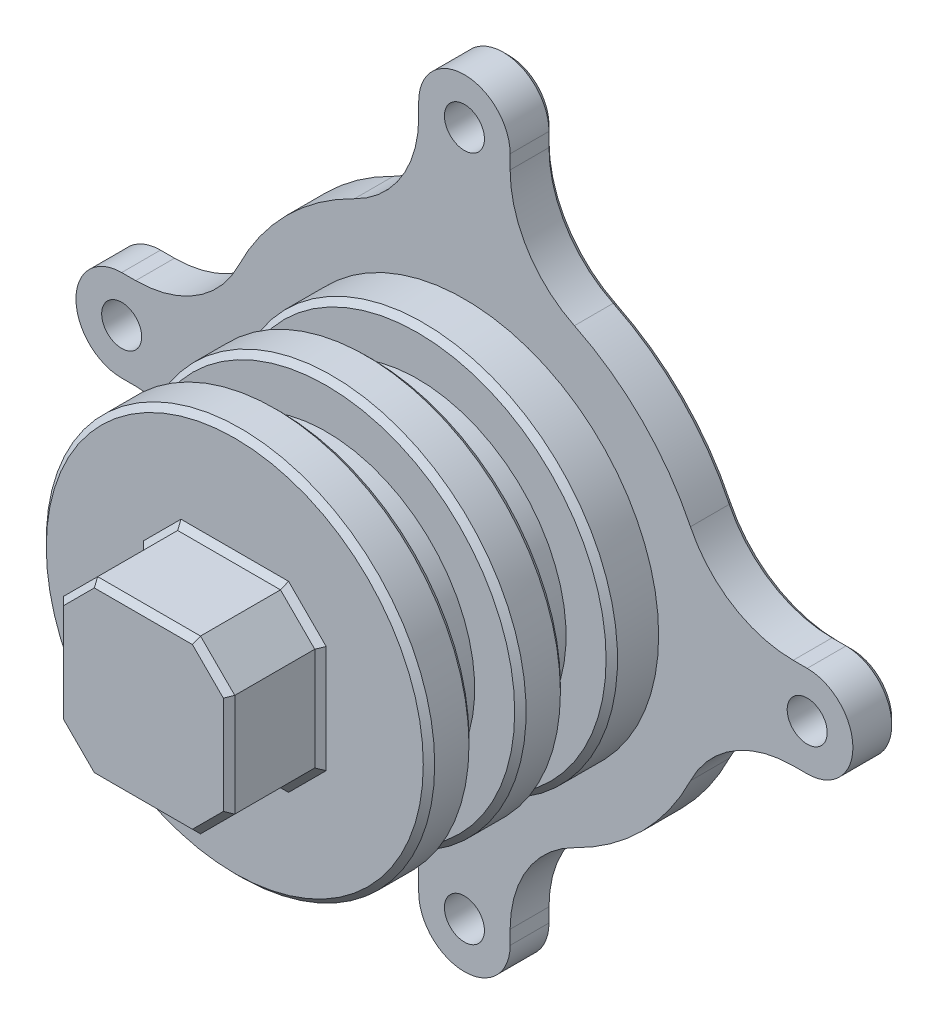
from build123d import *

# Parameters (mm, degrees)
SKETCH2_R           = 15
SKETCH1_R           = 25
SKETCH3_R           = 15
BOSS_EXTRUDE1_DEPTH = 5
FILLET1_R           = 10
SKETCH4_R           = 1.75
CUT_EXTRUDE1_DEPTH  = 130
SKETCH5_R           = 4
CUT_EXTRUDE2_DEPTH  = 130
SKETCH6_R           = 22
BOSS_EXTRUDE2_DEPTH = 4
SKETCH7_R           = 17
BOSS_EXTRUDE3_DEPTH = 20
SKETCH15_W          = 8.431609766
SKETCH15_H          = 4
SKETCH15_W_2        = 8.578672696
SKETCH18_R          = 12.5
CUT_EXTRUDE5_DEPTH  = 20
SKETCH19_R          = 47.987160243
CUT_EXTRUDE6_DEPTH  = 44.301270362
SKETCH20_R          = 1.75
BOSS_EXTRUDE5_DEPTH = 4
CIRPATTERN3_COUNT   = 4
FILLET2_R           = 10
CHAMFER1_SIZE       = 0.5
SKETCH22_W          = 15
SKETCH22_H          = 8
BOSS_EXTRUDE6_DEPTH = 7.5
CHAMFER2_SIZE       = 3
CHAMFER3_SIZE       = 0.5
CUT_EXTRUDE8_START  = -0.1
SKETCH24_R          = 41.017326151
SKETCH24_R_2        = 17
CUT_EXTRUDE8_DEPTH  = 0.1
CHAMFER4_SIZE       = 0.5


with BuildPart() as part:
    # Sketch2 → Loft1 section 0
    with BuildSketch(Plane.XY.offset(20)):
        Circle(SKETCH2_R)
    # Sketch1 → Loft1 section 1
    with BuildSketch(Plane.XY):
        Circle(SKETCH1_R)
    loft()

    # Sketch3 → Boss-Extrude1 (add)
    with BuildSketch(Plane.XY.offset(20)):
        Circle(SKETCH3_R)
    extrude(amount=BOSS_EXTRUDE1_DEPTH)

    # Fillet1
    fillet1_edges = [part.edges().sort_by_distance(p)[0] for p in [
        (-15, 0, 20),
    ]]
    fillet(fillet1_edges, radius=FILLET1_R)

    # Sketch4 → Cut-Extrude1 (cut)
    with BuildSketch(Plane(origin=(0, 0, 0), x_dir=(-1, 0, 0), z_dir=(0, 0, -1))):
        with Locations((0, 20)):
            Circle(SKETCH4_R)
        with Locations((-20, 0)):
            Circle(SKETCH4_R)
        with Locations((0, -20)):
            Circle(SKETCH4_R)
        with Locations((20, 0)):
            Circle(SKETCH4_R)
    extrude(amount=-CUT_EXTRUDE1_DEPTH, mode=Mode.SUBTRACT)

    # Sketch5 → Cut-Extrude2 (cut)
    with BuildSketch(Plane(origin=(0, 0, 3), x_dir=(-1, 0, 0), z_dir=(0, 0, -1))):
        with Locations((0, 20)):
            Circle(SKETCH5_R)
        with Locations((20, 0)):
            Circle(SKETCH5_R)
        with Locations((-20, 0)):
            Circle(SKETCH5_R)
        with Locations((0, -20)):
            Circle(SKETCH5_R)
    extrude(amount=-CUT_EXTRUDE2_DEPTH, mode=Mode.SUBTRACT)

    # Sketch6 → Boss-Extrude2 (add)
    with BuildSketch(Plane.XY.offset(25)):
        Circle(SKETCH6_R)
    extrude(amount=BOSS_EXTRUDE2_DEPTH)

    # Sketch7 → Boss-Extrude3 (add)
    with BuildSketch(Plane.XY.offset(29)):
        Circle(SKETCH7_R)
    extrude(amount=BOSS_EXTRUDE3_DEPTH)

    # Sketch15 → Cut-Revolve1 (revolve, cut)
    with BuildSketch(Plane(origin=(0, 0, 0), x_dir=(1, 0, 0), z_dir=(0, 1, 0))):
        with Locations((-17.215804883, -35)):
            Rectangle(SKETCH15_W, SKETCH15_H)
        with Locations((-17.289336348, -43)):
            Rectangle(SKETCH15_W_2, SKETCH15_H)
    revolve(axis=Axis((0, 0, 29), (0, 0, 1)), mode=Mode.SUBTRACT)

    # Sketch18 → Cut-Extrude5 (cut)
    with BuildSketch(Plane(origin=(0, 0, 0), x_dir=(-1, 0, 0), z_dir=(0, 0, -1))):
        Circle(SKETCH18_R)
    extrude(amount=-CUT_EXTRUDE5_DEPTH, mode=Mode.SUBTRACT)

    # Sketch19 → Cut-Extrude6 (cut, through all)
    with BuildSketch(Plane(origin=(0, 0, 25), x_dir=(-1, 0, 0), z_dir=(0, 0, -1))):
        Circle(SKETCH19_R)
    extrude(amount=CUT_EXTRUDE6_DEPTH, mode=Mode.SUBTRACT)

    # Sketch20 → Boss-Extrude5 (add)
    with BuildSketch(Plane(origin=(0, 0, 25), x_dir=(-1, 0, 0), z_dir=(0, 0, -1))):
        with BuildLine():
            Line((-4, 30), (-4, 21.633307653))
            ThreePointArc((-4, 21.633307653), (0, 22), (4, 21.633307653))
            Line((4, 21.633307653), (4, 30))
            ThreePointArc((4, 30), (0, 34), (-4, 30))
        make_face()
        with Locations((0, 30)):
            Circle(SKETCH20_R, mode=Mode.SUBTRACT)
    boss_extrude5 = extrude(amount=-BOSS_EXTRUDE5_DEPTH)

    # CirPattern3: Boss-Extrude5 ×4 about axis
    cirpattern3_axis = Axis((0, 0, 0), (0, 0, 1))
    for i in range(1, CIRPATTERN3_COUNT):
        add(boss_extrude5.rotate(cirpattern3_axis, i * 360 / CIRPATTERN3_COUNT))

    # Fillet2
    fillet2_edges = [part.edges().sort_by_distance(p)[0] for p in [
        (-4, 21.633307653, 27),
        (4, 21.633307653, 27),
        (-21.633307653, -4, 27),
        (-21.633307653, 4, 27),
        (4, -21.633307653, 27),
        (-4, -21.633307653, 27),
        (21.633307653, 4, 27),
        (21.633307653, -4, 27),
    ]]
    fillet(fillet2_edges, radius=FILLET2_R)

    # Chamfer1
    chamfer1_edges = [part.edges().sort_by_distance(p)[0] for p in [
        (-17, 0, 49),
        (-17, 0, 37),
        (-17, 0, 33),
        (-17, 0, 45),
        (-17, 0, 41),
    ]]
    chamfer(chamfer1_edges, length=CHAMFER1_SIZE)

    # Sketch22 → Boss-Extrude6 (add, symmetric)
    with BuildSketch(Plane(origin=(0, 0, 0), x_dir=(1, 0, 0), z_dir=(0, 1, 0))):
        with Locations((0, -53)):
            Rectangle(SKETCH22_W, SKETCH22_H)
    extrude(amount=BOSS_EXTRUDE6_DEPTH, both=True)

    # Chamfer2
    chamfer2_edges = [part.edges().sort_by_distance(p)[0] for p in [
        (7.5, -7.5, 53),
        (-7.5, -7.5, 53),
        (7.5, 7.5, 53),
        (-7.5, 7.5, 53),
    ]]
    chamfer(chamfer2_edges, length=CHAMFER2_SIZE)

    # Chamfer3
    chamfer3_edges = [part.edges().sort_by_distance(p)[0] for p in [
        (7.5, 0, 49),
        (7.5, 0, 57),
        (0, -7.5, 57),
        (0, -7.5, 49),
        (0, 7.5, 57),
        (-7.5, 0, 57),
        (-6, 6, 57),
        (-6, -6, 57),
        (6, 6, 57),
        (6, -6, 57),
        (0, 7.5, 49),
        (-7.5, 0, 49),
        (6, -6, 49),
        (6, 6, 49),
        (-6, -6, 49),
        (-6, 6, 49),
    ]]
    chamfer(chamfer3_edges, length=CHAMFER3_SIZE)

    # Sketch24 → Cut-Extrude8 (cut)
    with BuildSketch(Plane.XY.offset(29).offset(CUT_EXTRUDE8_START)):
        Circle(SKETCH24_R)
        with Locations(Location((0, 0, 0), (0, 0, 180))):
            Circle(SKETCH24_R_2, mode=Mode.SUBTRACT)
    extrude(amount=CUT_EXTRUDE8_DEPTH, mode=Mode.SUBTRACT)

    # Chamfer4
    chamfer4_edges = [part.edges().sort_by_distance(p)[0] for p in [
        (0, 34, 25),
        (4, 29.38749457, 25),
        (1.75, 30, 25),
        (-34, 0, 25),
        (-29.38749457, 4, 25),
        (-30, 1.75, 25),
        (0, -34, 25),
        (-4, -29.38749457, 25),
        (-1.75, -30, 25),
        (34, 0, 25),
        (29.38749457, -4, 25),
        (30, -1.75, 25),
        (15.556349186, 15.556349186, 25),
        (29.38749457, 4, 25),
        (15.556349186, -15.556349186, 25),
        (4, -29.38749457, 25),
        (-15.556349186, -15.556349186, 25),
        (-29.38749457, -4, 25),
        (-15.556349186, 15.556349186, 25),
        (-4, 29.38749457, 25),
        (23.471688281, 5.522087521, 25),
        (23.471688281, -5.522087521, 25),
        (5.522087521, -23.471688281, 25),
        (-5.522087521, -23.471688281, 25),
        (-23.471688281, -5.522087521, 25),
        (-23.471688281, 5.522087521, 25),
        (-5.522087521, 23.471688281, 25),
        (5.522087521, 23.471688281, 25),
    ]]
    chamfer(chamfer4_edges, length=CHAMFER4_SIZE)


solid = part.part
